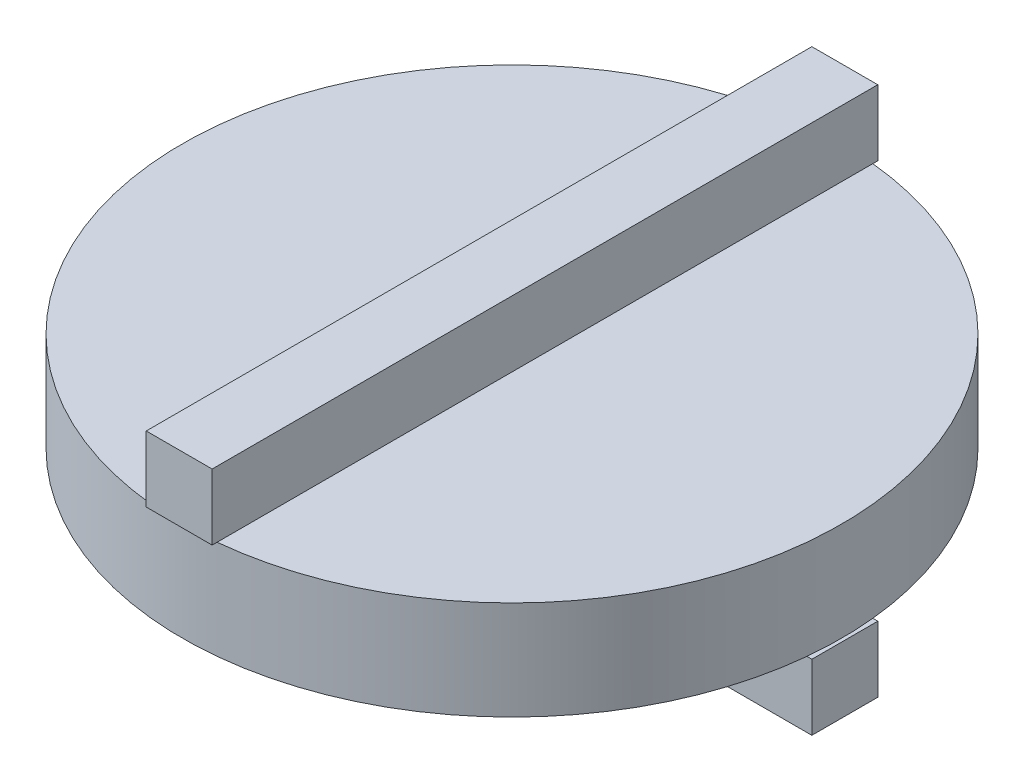
from build123d import *

# Parameters (mm, degrees)
SKETCH1_R           = 50
BOSS_EXTRUDE1_DEPTH = 15
SKETCH2_W           = 10
SKETCH2_H           = 101
BOSS_EXTRUDE2_DEPTH = 10
SKETCH3_W           = 101
SKETCH3_H           = 10
BOSS_EXTRUDE3_DEPTH = 10


with BuildPart() as part:
    # Sketch1 → Boss-Extrude1 (new body)
    with BuildSketch(Plane(origin=(0, 0, 0), x_dir=(1, 0, 0), z_dir=(0, 1, 0))):
        with Locations(Location((0, 0, 0), (0, 0, 270))):
            Circle(SKETCH1_R)
    extrude(amount=BOSS_EXTRUDE1_DEPTH)

    # Sketch2 → Boss-Extrude2 (add)
    with BuildSketch(Plane(origin=(0, 15, 0), x_dir=(1, 0, 0), z_dir=(0, 1, 0))):
        Rectangle(SKETCH2_W, SKETCH2_H)
    extrude(amount=BOSS_EXTRUDE2_DEPTH)

    # Sketch3 → Boss-Extrude3 (add)
    with BuildSketch(Plane.XZ):
        Rectangle(SKETCH3_W, SKETCH3_H)
    extrude(amount=BOSS_EXTRUDE3_DEPTH)


solid = part.part
